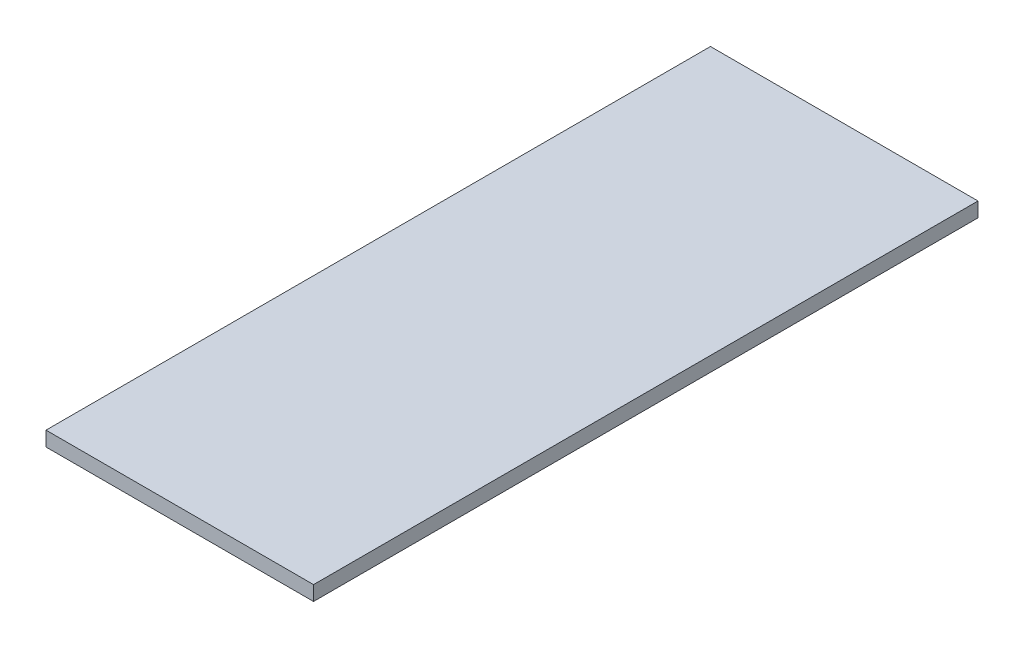
from build123d import *

# Parameters (mm, degrees)
SKETCH_1_W      = 18.28
SKETCH_1_H      = 45.4
EXTRUDE_1_DEPTH = 1


with BuildPart() as part:
    # Эскиз1 → Бобышка-Вытянуть1 (new body)
    with BuildSketch(Plane(origin=(0, 0, 0), x_dir=(1, 0, 0), z_dir=(0, 1, 0))):
        with Locations((0, -2.3)):
            Rectangle(SKETCH_1_W, SKETCH_1_H)
    extrude(amount=EXTRUDE_1_DEPTH)


solid = part.part
